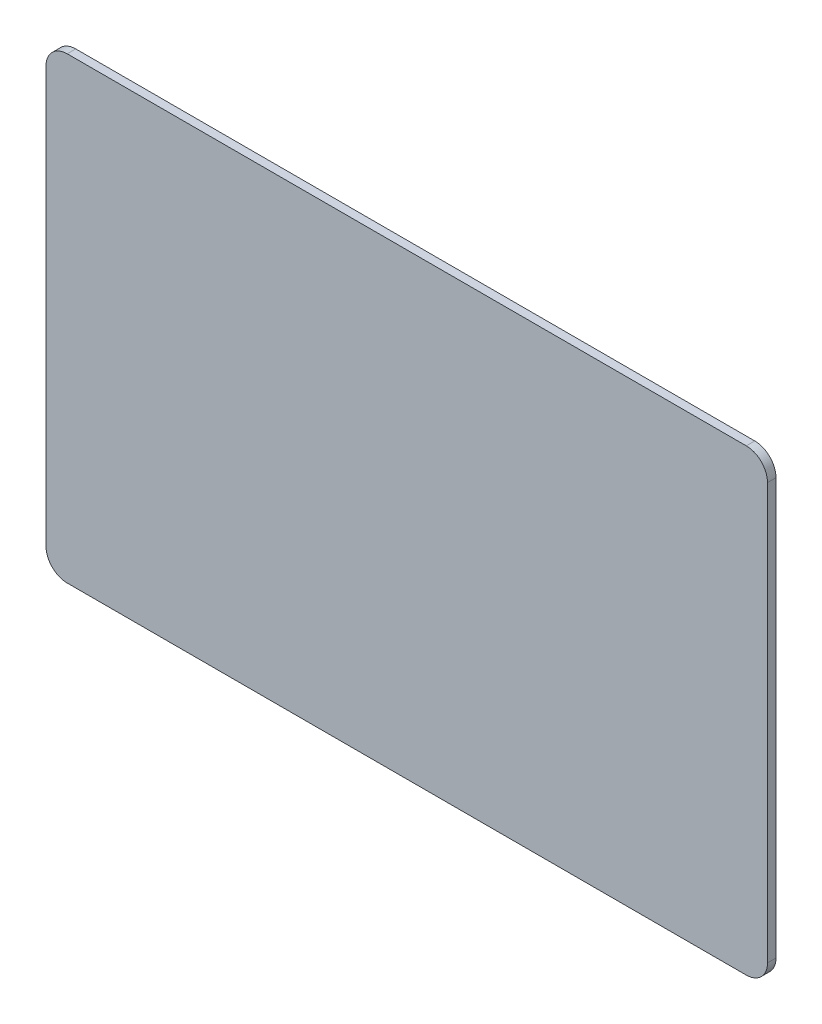
from build123d import *

# Parameters (mm, degrees)
BOSS_EXTRUDE1_DEPTH = 1


with BuildPart() as part:
    # Sketch1 → Boss-Extrude1 (new body)
    with BuildSketch(Plane.XY):
        with BuildLine():
            Line((2.5, 0), (82.5, 0))
            ThreePointArc((82.5, 0), (84.267766953, 0.732233047), (85, 2.5))
            Line((85, 2.5), (85, 51.5))
            ThreePointArc((85, 51.5), (84.267766953, 53.267766953), (82.5, 54))
            Line((82.5, 54), (2.5, 54))
            ThreePointArc((2.5, 54), (0.732233047, 53.267766953), (0, 51.5))
            Line((0, 51.5), (0, 2.5))
            ThreePointArc((0, 2.5), (0.732233047, 0.732233047), (2.5, 0))
        make_face()
    extrude(amount=BOSS_EXTRUDE1_DEPTH)


solid = part.part
